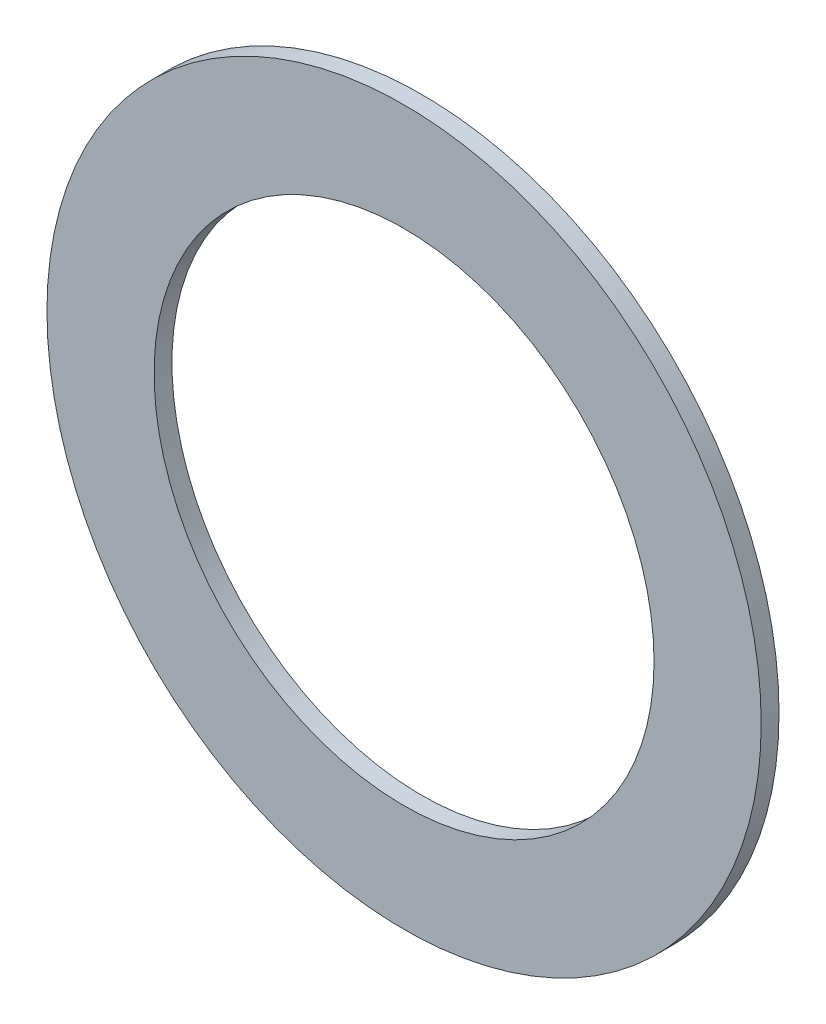
from build123d import *

# Parameters (mm, degrees)
SKETCH3_R           = 31.75
SKETCH3_R_2         = 22.225
BOSS_EXTRUDE1_DEPTH = 1.5875


with BuildPart() as part:
    # Sketch3 → Boss-Extrude1 (new body)
    with BuildSketch(Plane.XY):
        Circle(SKETCH3_R)
        Circle(SKETCH3_R_2, mode=Mode.SUBTRACT)
    extrude(amount=-BOSS_EXTRUDE1_DEPTH)


solid = part.part
